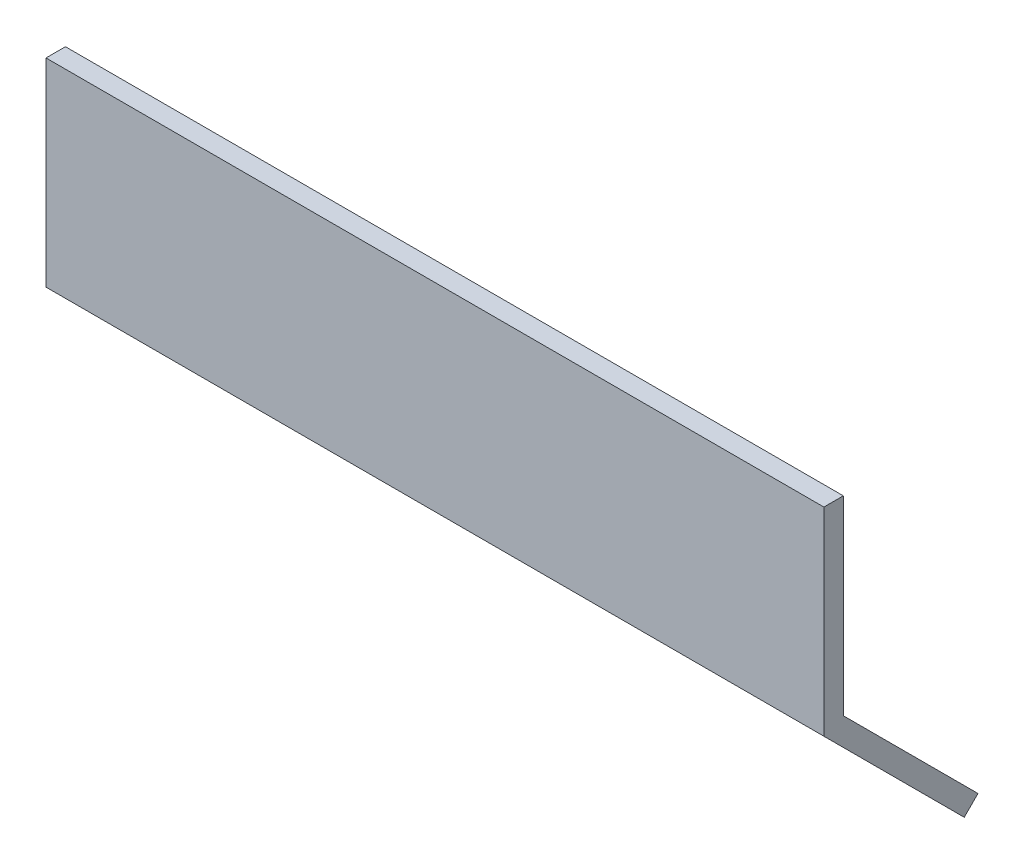
from build123d import *

# Parameters (mm, degrees)
EXTRUDE_THIN1_DEPTH = 200
CUT_EXTRUDE1_REACH  = 210.749
SKETCH3_R           = 1.5


with BuildPart() as part:
    # Sketch2 → Extrude-Thin1 (new body)
    with BuildSketch(Plane(origin=(0, 0, 0), x_dir=(0, 0, -1), z_dir=(1, 0, 0))):
        Polygon((-2.5, 50), (-2.5, -1.035533906), (33.587572106, -37.123106012), (37.123106012, -33.587572106), (2.5, 1.035533906), (2.5, 50), align=None)
    extrude(amount=EXTRUDE_THIN1_DEPTH)

    # Sketch3 → Cut-Extrude1 (cut, up to next)
    with BuildSketch(Plane(origin=(0, 1.767766953, -1.767766953), x_dir=(1, 0, 0), z_dir=(0, 0.7071067811865489, -0.7071067811865462)), mode=Mode.PRIVATE) as cut_extrude1_sk1:
        with Locations(Location((132, 42, 0), (0, 0, 270))):
            Circle(SKETCH3_R)
    cut_extrude1_tool1 = extrude(cut_extrude1_sk1.sketch, amount=-CUT_EXTRUDE1_REACH, mode=Mode.PRIVATE) & part.part
    # Sketch3 → Cut-Extrude1 (cut, up to next)
    with BuildSketch(Plane(origin=(0, 1.767766953, -1.767766953), x_dir=(1, 0, 0), z_dir=(0, 0.7071067811865489, -0.7071067811865462)), mode=Mode.PRIVATE) as cut_extrude1_sk2:
        with Locations(Location((196, 42, 0), (0, 0, 270))):
            Circle(SKETCH3_R)
    cut_extrude1_tool2 = extrude(cut_extrude1_sk2.sketch, amount=-CUT_EXTRUDE1_REACH, mode=Mode.PRIVATE) & part.part
    add(cut_extrude1_tool1.solids().sort_by_distance((132, -27.930718, -31.466252))[0], mode=Mode.SUBTRACT)
    add(cut_extrude1_tool2.solids().sort_by_distance((196, -27.930718, -31.466252))[0], mode=Mode.SUBTRACT)


solid = part.part
